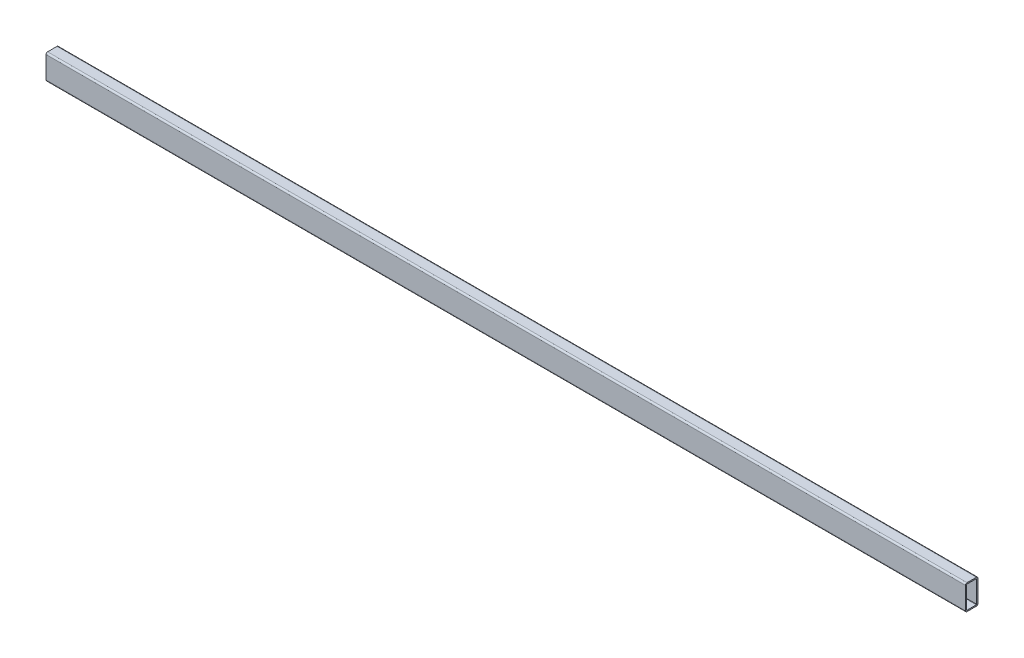
from build123d import *

# Parameters (mm, degrees)
RECTANGULAR_TUBE_CONFIGURED_60_X_40_X_DEPTH = 1465


with BuildPart() as part:
    # Sketch1 → Rectangular tube - configured 60 X 40 X 3.2(2) (new body)
    with BuildSketch(Plane.YZ.offset(-732.5)):
        with BuildLine():
            Line((-17.5, -10), (17.5, -10))
            ThreePointArc((17.5, -10), (19.267766953, -9.267766953), (20, -7.5))
            Line((20, -7.5), (20, 7.5))
            ThreePointArc((20, 7.5), (19.267766953, 9.267766953), (17.5, 10))
            Line((17.5, 10), (-17.5, 10))
            ThreePointArc((-17.5, 10), (-19.267766953, 9.267766953), (-20, 7.5))
            Line((-20, 7.5), (-20, -7.5))
            ThreePointArc((-20, -7.5), (-19.267766953, -9.267766953), (-17.5, -10))
        make_face()
        with BuildLine():
            Line((-17.5, -8), (17.5, -8))
            ThreePointArc((17.5, -8), (17.853553391, -7.853553391), (18, -7.5))
            Line((18, -7.5), (18, 7.5))
            ThreePointArc((18, 7.5), (17.853553391, 7.853553391), (17.5, 8))
            Line((17.5, 8), (-17.5, 8))
            ThreePointArc((-17.5, 8), (-17.853553391, 7.853553391), (-18, 7.5))
            Line((-18, 7.5), (-18, -7.5))
            ThreePointArc((-18, -7.5), (-17.853553391, -7.853553391), (-17.5, -8))
        make_face(mode=Mode.SUBTRACT)
    extrude(amount=RECTANGULAR_TUBE_CONFIGURED_60_X_40_X_DEPTH)


solid = part.part
